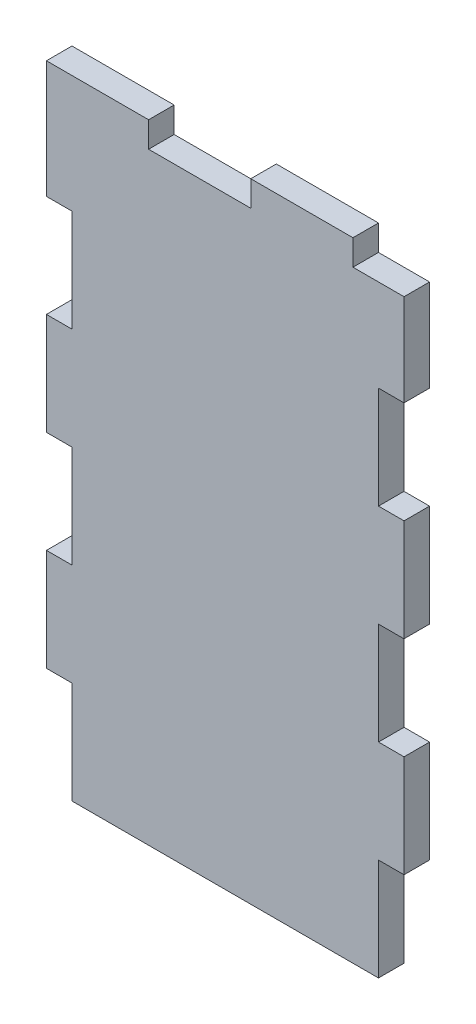
from build123d import *

# Parameters (mm, degrees)
SKETCH_1_W                      = 70
SKETCH_1_H                      = 118
EXTRUDE_1_DEPTH                 = 5
CUT_EXTRUDE_1_REACH             = 70.782
SKETCH_2_W                      = 5
SKETCH_2_H                      = 20
CUT_EXTRUDE_1_DIRECTION_2_DEPTH = 69.782265156
PATTERN_LINEAR_1_COUNT          = 3
PATTERN_LINEAR_1_PITCH          = 40
CUT_EXTRUDE_3_REACH             = 70.782
SKETCH_4_W                      = 5
SKETCH_4_H                      = 20
PATTERN_LINEAR_4_COUNT          = 3
PATTERN_LINEAR_4_PITCH          = 40
SKETCH_3_W                      = 20
SKETCH_3_H                      = 5
EXTRUDE_2_DEPTH                 = 5
PATTERN_LINEAR_5_COUNT          = 2
PATTERN_LINEAR_5_PITCH          = 40


with BuildPart() as part:
    # 스케치1 → 보스-돌출1 (new body)
    with BuildSketch(Plane.XY):
        Rectangle(SKETCH_1_W, SKETCH_1_H)
    extrude(amount=EXTRUDE_1_DEPTH)

    # 스케치2 → 컷-돌출1 (cut, up to next)
    with BuildSketch(Plane.XY.offset(5), mode=Mode.PRIVATE) as cut_extrude_1_sk1:
        with Locations((-32.5, -49)):
            Rectangle(SKETCH_2_W, SKETCH_2_H)
    cut_extrude_1_tool1 = extrude(cut_extrude_1_sk1.sketch, amount=-CUT_EXTRUDE_1_REACH, mode=Mode.PRIVATE) & part.part
    cut_extrude_1 = cut_extrude_1_tool1.solids().sort_by_distance((-32.5, -49, 5))[0]
    add(cut_extrude_1, mode=Mode.SUBTRACT)

    # 스케치2 → 컷-돌출1 direction 2 (cut)
    with BuildSketch(Plane.XY.offset(5)):
        with Locations((-32.5, -49)):
            Rectangle(SKETCH_2_W, SKETCH_2_H)
    cut_extrude_1_direction_2 = extrude(amount=CUT_EXTRUDE_1_DIRECTION_2_DEPTH, mode=Mode.SUBTRACT)

    # 선형 패턴1: 컷-돌출1, 컷-돌출1 direction 2 ×3
    with Locations(*[(0, i * PATTERN_LINEAR_1_PITCH, 0) for i in range(1, PATTERN_LINEAR_1_COUNT)]):
        add(cut_extrude_1, mode=Mode.SUBTRACT)
        add(cut_extrude_1_direction_2, mode=Mode.SUBTRACT)

    # 스케치4 → 컷-돌출3 (cut, up to next)
    with BuildSketch(Plane.XY.offset(5), mode=Mode.PRIVATE) as cut_extrude_3_sk1:
        with Locations((32.5, -49)):
            Rectangle(SKETCH_4_W, SKETCH_4_H)
    cut_extrude_3_tool1 = extrude(cut_extrude_3_sk1.sketch, amount=-CUT_EXTRUDE_3_REACH, mode=Mode.PRIVATE) & part.part
    cut_extrude_3 = cut_extrude_3_tool1.solids().sort_by_distance((32.5, -49, 5))[0]
    add(cut_extrude_3, mode=Mode.SUBTRACT)

    # 선형 패턴4: 컷-돌출3 ×3
    with Locations(*[(0, i * PATTERN_LINEAR_4_PITCH, 0) for i in range(1, PATTERN_LINEAR_4_COUNT)]):
        add(cut_extrude_3, mode=Mode.SUBTRACT)

    # 스케치3 → 보스-돌출2 (add)
    with BuildSketch(Plane.XY.offset(5)):
        with Locations((-25, 61.5)):
            Rectangle(SKETCH_3_W, SKETCH_3_H)
    extrude_2 = extrude(amount=-EXTRUDE_2_DEPTH)

    # 선형 패턴5: 보스-돌출2 ×2
    with Locations(*[(i * PATTERN_LINEAR_5_PITCH, 0, 0) for i in range(1, PATTERN_LINEAR_5_COUNT)]):
        add(extrude_2)


solid = part.part
